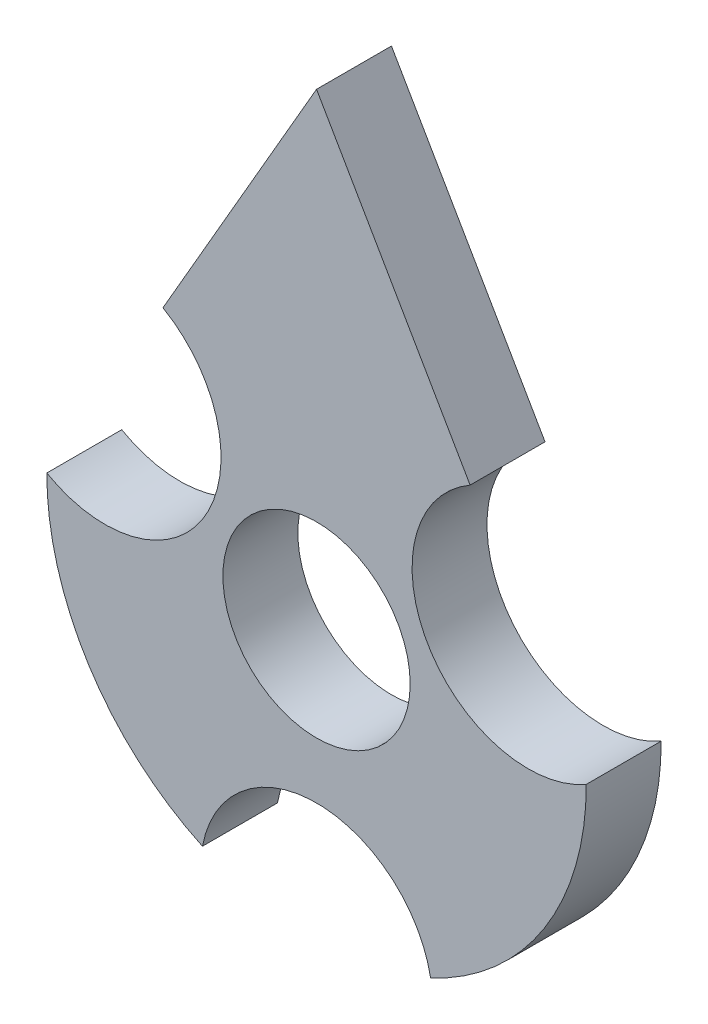
from build123d import *

# Parameters (mm, degrees)
SKETCH1_R           = 25
BOSS_EXTRUDE1_DEPTH = 10


with BuildPart() as part:
    # Sketch1 → Boss-Extrude1 (new, symmetric)
    with BuildSketch(Plane.XY):
        with BuildLine():
            Line((0, 125), (-41, 53.98591689))
            ThreePointArc((-41, 53.98591689), (-29.653041557, 11.639425428), (-71.999407886, 0.292000007))
            ThreePointArc((-71.999407886, 0.292000007), (-60.81182851, -38.5476525), (-30.460070741, -65.23943662))
            ThreePointArc((-30.460070741, -65.23943662), (0, -40), (30.460070741, -65.23943662))
            ThreePointArc((30.460070741, -65.23943662), (60.81182851, -38.5476525), (71.999407886, 0.292000007))
            ThreePointArc((71.999407886, 0.292000007), (29.653041557, 11.639425428), (41, 53.98591689))
            Line((41, 53.98591689), (0, 125))
        make_face()
        Circle(SKETCH1_R, mode=Mode.SUBTRACT)
    extrude(amount=BOSS_EXTRUDE1_DEPTH, both=True)


solid = part.part
